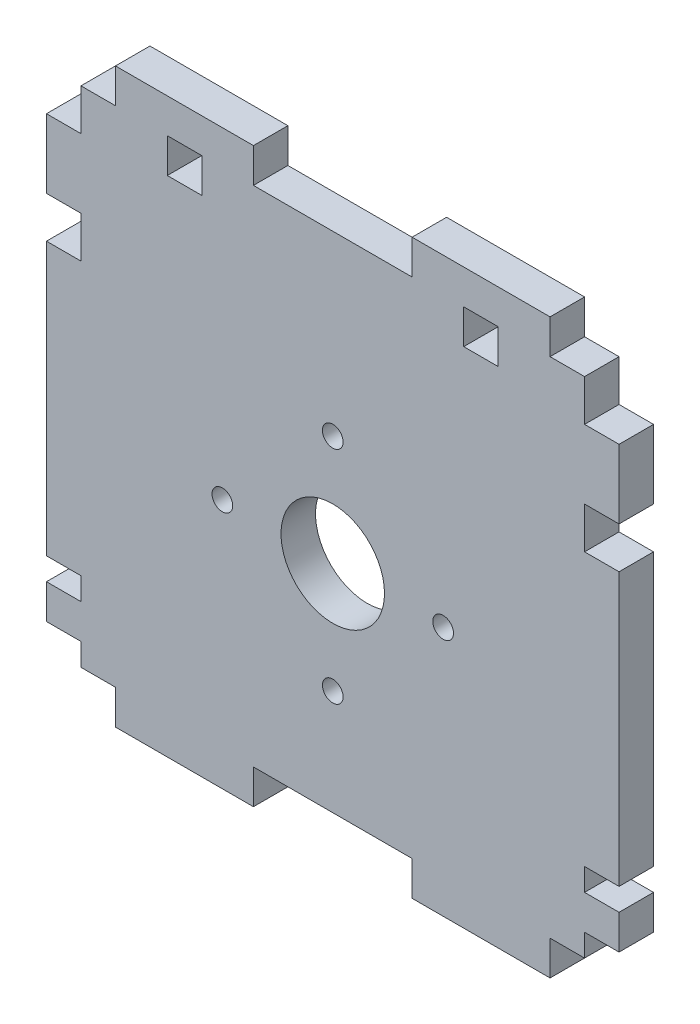
from build123d import *

# Parameters (mm, degrees)
ESQUISSE1_W             = 83
ESQUISSE1_H             = 73
ESQUISSE1_R             = 7.5
BOSS_EXTRU_1_DEPTH      = 5
ESQUISSE2_R             = 1.5
ESQUISSE2_W             = 5
ESQUISSE2_H             = 6
ESQUISSE2_H_2           = 3.25
ESQUISSE2_H_3           = 5
ENL_V_MAT_EXTRU_1_DEPTH = 5
ESQUISSE3_W             = 20
ESQUISSE3_H             = 5
BOSS_EXTRU_2_DEPTH      = 5


with BuildPart() as part:
    # Esquisse1 → Boss.-Extru.1 (new body)
    with BuildSketch(Plane.XY):
        with Locations((41.5, 36.5)):
            Rectangle(ESQUISSE1_W, ESQUISSE1_H)
        with Locations((41.5, 31.275)):
            Circle(ESQUISSE1_R, mode=Mode.SUBTRACT)
    extrude(amount=BOSS_EXTRU_1_DEPTH)

    # Esquisse2 → Enlèv. mat.-Extru.1 (cut)
    with BuildSketch(Plane.XY.offset(5)):
        with Locations((41.5, 47.275)):
            Circle(ESQUISSE2_R)
        with Locations((25.5, 31.275)):
            Circle(ESQUISSE2_R)
        with Locations((57.5, 31.275)):
            Circle(ESQUISSE2_R)
        with Locations((41.5, 15.275)):
            Circle(ESQUISSE2_R)
        with Locations((80.5, 70)):
            Rectangle(ESQUISSE2_W, ESQUISSE2_H)
        with Locations((80.5, 54)):
            Rectangle(ESQUISSE2_W, ESQUISSE2_H)
        with Locations((80.5, 1.625)):
            Rectangle(ESQUISSE2_W, ESQUISSE2_H_2)
        with Locations((80.5, 9.875)):
            Rectangle(ESQUISSE2_W, ESQUISSE2_H_2)
        with Locations((2.5, 9.875)):
            Rectangle(ESQUISSE2_W, ESQUISSE2_H_2)
        with Locations((2.5, 1.625)):
            Rectangle(ESQUISSE2_W, ESQUISSE2_H_2)
        with Locations((2.5, 54)):
            Rectangle(ESQUISSE2_W, ESQUISSE2_H)
        with Locations((2.5, 70)):
            Rectangle(ESQUISSE2_W, ESQUISSE2_H)
        with Locations((20.016662646, 70.5)):
            Rectangle(ESQUISSE2_W, ESQUISSE2_H_3)
        with Locations((62.983337354, 70.5)):
            Rectangle(ESQUISSE2_W, ESQUISSE2_H_3)
    extrude(amount=-ENL_V_MAT_EXTRU_1_DEPTH, mode=Mode.SUBTRACT)

    # Esquisse3 → Boss.-Extru.2 (add)
    with BuildSketch(Plane.XY.offset(5)):
        with Locations((63, 75.5)):
            Rectangle(ESQUISSE3_W, ESQUISSE3_H)
        with Locations((20, 75.5)):
            Rectangle(ESQUISSE3_W, ESQUISSE3_H)
        with Locations((63, -2.5)):
            Rectangle(ESQUISSE3_W, ESQUISSE3_H)
        with Locations((20, -2.5)):
            Rectangle(ESQUISSE3_W, ESQUISSE3_H)
    extrude(amount=-BOSS_EXTRU_2_DEPTH)


solid = part.part
